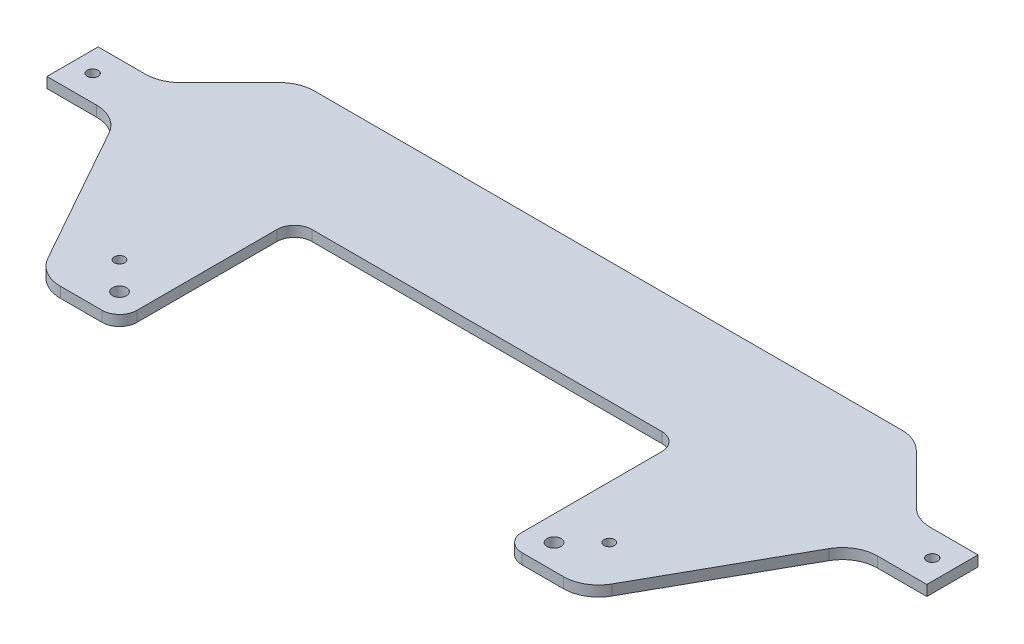
from build123d import *

# Parameters (mm, degrees)
SALIENTE_EXTRUIR1_DEPTH = 3
REDONDEO1_R             = 10
CROQUIS2_R              = 1.5
CROQUIS2_R_2            = 1.55
CORTAR_EXTRUIR1_DEPTH   = 135.610141171
CROQUIS4_W              = 110
CROQUIS4_H              = 50
CORTAR_EXTRUIR2_DEPTH   = 135.610141171
REDONDEO2_R             = 5
CROQUIS5_W              = 4
CROQUIS5_H              = 14.636342218
CORTAR_EXTRUIR3_DEPTH   = 135.610141171
CROQUIS6_W              = 14.636342218
CROQUIS6_H              = 3
SALIENTE_EXTRUIR2_DEPTH = 2
CROQUIS8_W              = 14.636342218
CROQUIS8_H              = 3
SALIENTE_EXTRUIR3_DEPTH = 2
CROQUIS9_R              = 2
CORTAR_EXTRUIR4_DEPTH   = 133.713564137


with BuildPart() as part:
    # Croquis1 → Saliente-Extruir1 (new body)
    with BuildSketch(Plane(origin=(0, 0, 0), x_dir=(1, 0, 0), z_dir=(0, 1, 0))):
        Polygon((-88.1, 42.318171109), (88.1, 42.318171109), (108.1, 22.318171109), (127.75, 22.318171109), (127.75, 7.681828891), (105.75, 7.681828891), (77.75, -42.318171109), (-77.75, -42.318171109), (-105.75, 7.681828891), (-127.75, 7.681828891), (-127.75, 22.318171109), (-108.1, 22.318171109), align=None)
    extrude(amount=SALIENTE_EXTRUIR1_DEPTH)

    # Redondeo1
    redondeo1_edges = [part.edges().sort_by_distance(p)[0] for p in [
        (-88.1, 1.5, -42.318171109),
        (88.1, 1.5, -42.318171109),
        (108.1, 1.5, -22.318171109),
        (105.75, 1.5, -7.681828891),
        (77.75, 1.5, 42.318171109),
        (-77.75, 1.5, 42.318171109),
        (-105.75, 1.5, -7.681828891),
        (-108.1, 1.5, -22.318171109),
    ]]
    fillet(redondeo1_edges, radius=REDONDEO1_R)

    # Croquis2 → Cortar-Extruir1 (cut, through all)
    with BuildSketch(Plane(origin=(0, 3, 0), x_dir=(1, 0, 0), z_dir=(0, 1, 0))):
        with Locations(Location((70, -27.318171109, 0), (0, 0, 270))):
            Circle(CROQUIS2_R)
        with Locations(Location((-70, -27.318171109, 0), (0, 0, 270))):
            Circle(CROQUIS2_R)
        with Locations(Location((-119.996067812, 15, 0), (0, 0, 270))):
            Circle(CROQUIS2_R_2)
        with Locations(Location((119.996067812, 15, 0), (0, 0, 270))):
            Circle(CROQUIS2_R_2)
        with Locations(Location((-17.5, -17.318171109, 0), (0, 0, 270))):
            Circle(CROQUIS2_R)
        with Locations(Location((17.5, -17.318171109, 0), (0, 0, 270))):
            Circle(CROQUIS2_R)
        with Locations(Location((-17.5, -37.318171109, 0), (0, 0, 270))):
            Circle(CROQUIS2_R)
        with Locations(Location((17.5, -37.318171109, 0), (0, 0, 270))):
            Circle(CROQUIS2_R)
    extrude(amount=-CORTAR_EXTRUIR1_DEPTH, mode=Mode.SUBTRACT)

    # Croquis4 → Cortar-Extruir2 (cut, through all)
    with BuildSketch(Plane(origin=(0, 3, 0), x_dir=(1, 0, 0), z_dir=(0, 1, 0))):
        with Locations((0, -17.318171109)):
            Rectangle(CROQUIS4_W, CROQUIS4_H)
    extrude(amount=-CORTAR_EXTRUIR2_DEPTH, mode=Mode.SUBTRACT)

    # Redondeo2
    redondeo2_edges = [part.edges().sort_by_distance(p)[0] for p in [
        (55, 1.5, 42.318171109),
        (-55, 1.5, 42.318171109),
        (-55, 1.5, -7.681828891),
        (55, 1.5, -7.681828891),
    ]]
    fillet(redondeo2_edges, radius=REDONDEO2_R)

    # Croquis5 → Cortar-Extruir3 (cut, through all)
    with BuildSketch(Plane(origin=(0, 3, 0), x_dir=(1, 0, 0), z_dir=(0, 1, 0))):
        with Locations((-125.75, 15)):
            Rectangle(CROQUIS5_W, CROQUIS5_H)
        with Locations((125.75, 15)):
            Rectangle(CROQUIS5_W, CROQUIS5_H)
    extrude(amount=-CORTAR_EXTRUIR3_DEPTH, mode=Mode.SUBTRACT)

    # Croquis6 → Saliente-Extruir2 (add)
    with BuildSketch(Plane(origin=(123.75, 0, 0), x_dir=(0, 0, -1), z_dir=(1, 0, 0))):
        with Locations((15, 1.5)):
            Rectangle(CROQUIS6_W, CROQUIS6_H)
    extrude(amount=SALIENTE_EXTRUIR2_DEPTH)

    # Croquis8 → Saliente-Extruir3 (add)
    with BuildSketch(Plane.ZY.offset(123.75)):
        with Locations((-15, 1.5)):
            Rectangle(CROQUIS8_W, CROQUIS8_H)
    extrude(amount=SALIENTE_EXTRUIR3_DEPTH)

    # Croquis9 → Cortar-Extruir4 (cut, through all)
    with BuildSketch(Plane(origin=(0, 3, 0), x_dir=(1, 0, 0), z_dir=(0, 1, 0))):
        with Locations(Location((-62.1, -35.218171109, 0), (0, 0, 270))):
            Circle(CROQUIS9_R)
    cortar_extruir4 = extrude(amount=-CORTAR_EXTRUIR4_DEPTH, mode=Mode.SUBTRACT)

    # Simetría1: Cortar-Extruir4 across plane
    add(cortar_extruir4.mirror(Plane(origin=(0, 0, 0), x_dir=(0, 0, 1), z_dir=(1, 0, 0))), mode=Mode.SUBTRACT)


solid = part.part
